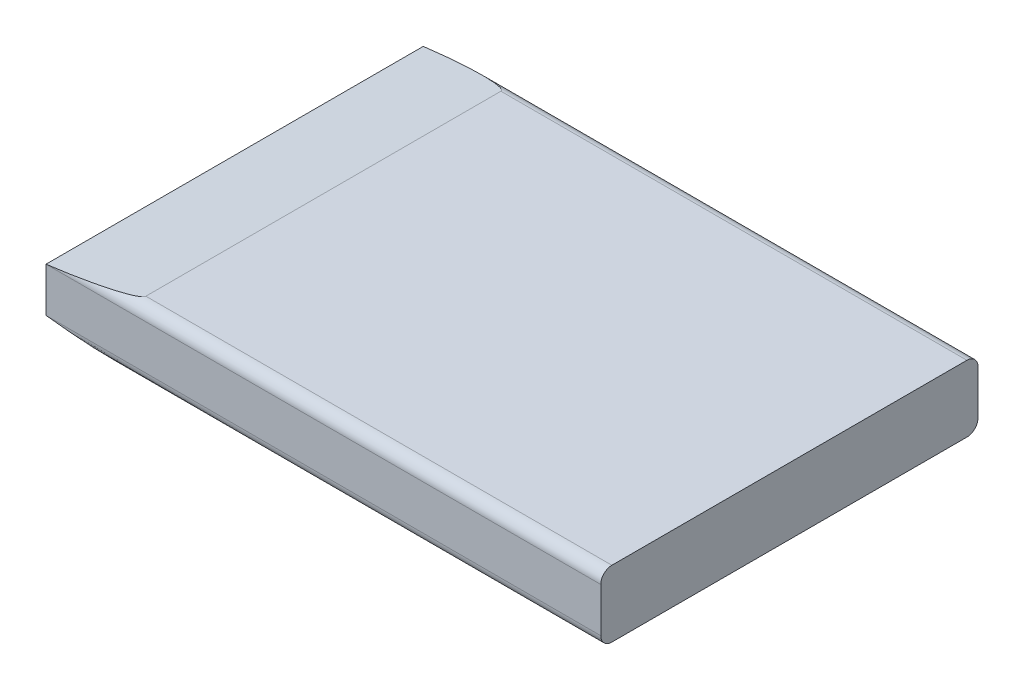
from build123d import *

# Parameters (mm, degrees)
SKETCH_1_W          = 50
SKETCH_1_H          = 34
EXTRUDE_1_DEPTH     = 6
FILLET_1_R          = 1
CUT_EXTRUDE_1_DEPTH = 40


with BuildPart() as part:
    # 草图1 → 凸台-拉伸1 (new body)
    with BuildSketch(Plane(origin=(0, 0, 0), x_dir=(1, 0, 0), z_dir=(0, 1, 0))):
        Rectangle(SKETCH_1_W, SKETCH_1_H)
    extrude(amount=EXTRUDE_1_DEPTH)

    # 圆角1
    fillet_1_edges = [part.edges().sort_by_distance(p)[0] for p in [
        (0, 6, 17),
        (0, 0, 17),
        (0, 0, -17),
        (0, 6, -17),
    ]]
    fillet(fillet_1_edges, radius=FILLET_1_R)

    # 草图2 → 切除-拉伸1 (cut)
    with BuildSketch(Plane.XY.offset(17)):
        Polygon((-25, 5), (-17, 6), (-17, 8), (-27, 8), (-27, -2), (-17, -2), (-17, 0), (-25, 1), align=None)
    extrude(amount=-CUT_EXTRUDE_1_DEPTH, mode=Mode.SUBTRACT)


solid = part.part
